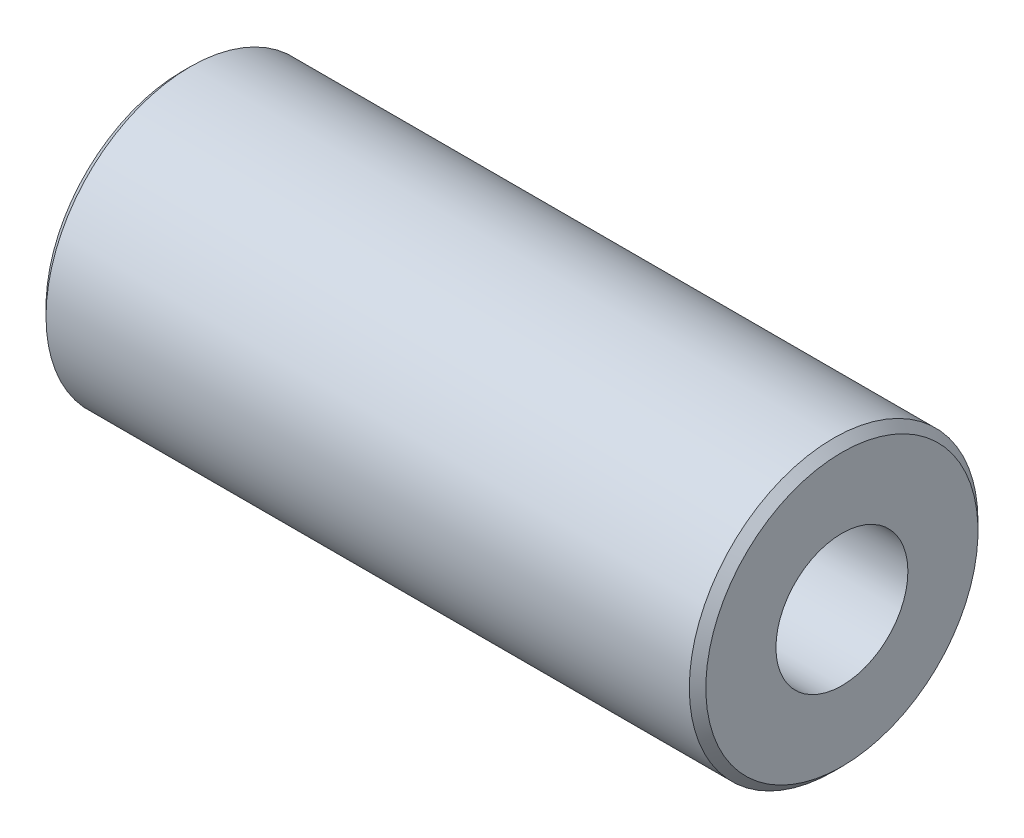
from build123d import *

# Parameters (mm, degrees)
SKETCH_1_W     = 8
SKETCH_1_H     = 1.75
CHAMFER_1_SIZE = 0.1


with BuildPart() as part:
    # 草图1 → 旋转1 (revolve)
    with BuildSketch(Plane.XY, mode=Mode.PRIVATE) as revolve_1_sk:
        with Locations((0, 0.875)):
            Rectangle(SKETCH_1_W, SKETCH_1_H)
    revolve(revolve_1_sk.sketch.rotate(Axis((-4, 0, 0), (1, 0, 0)), 180), axis=Axis((-4, 0, 0), (1, 0, 0)))

    # 草图3 → Hole Wizard 380 (revolve, cut)
    with BuildSketch(Plane(origin=(-4, 0, 0), x_dir=(0, 0, 1), z_dir=(0, 1, 0))):
        Polygon((0, 0), (0, 6.480688495), (0.8, 6), (0.8, 0), align=None)
    hole_wizard_380 = revolve(axis=Axis((-10.35, 0, 0), (1, 0, 0)), mode=Mode.SUBTRACT)

    # 镜向1: Hole Wizard 380 across plane
    add(hole_wizard_380.mirror(Plane(origin=(0, 0, 0), x_dir=(0, 0, 1), z_dir=(1, 0, 0))), mode=Mode.SUBTRACT)

    # 倒角1
    chamfer_1_edges = [part.edges().sort_by_distance(p)[0] for p in [
        (-4, 1.75, 0),
        (4, 1.75, 0),
    ]]
    chamfer(chamfer_1_edges, length=CHAMFER_1_SIZE)


solid = part.part
